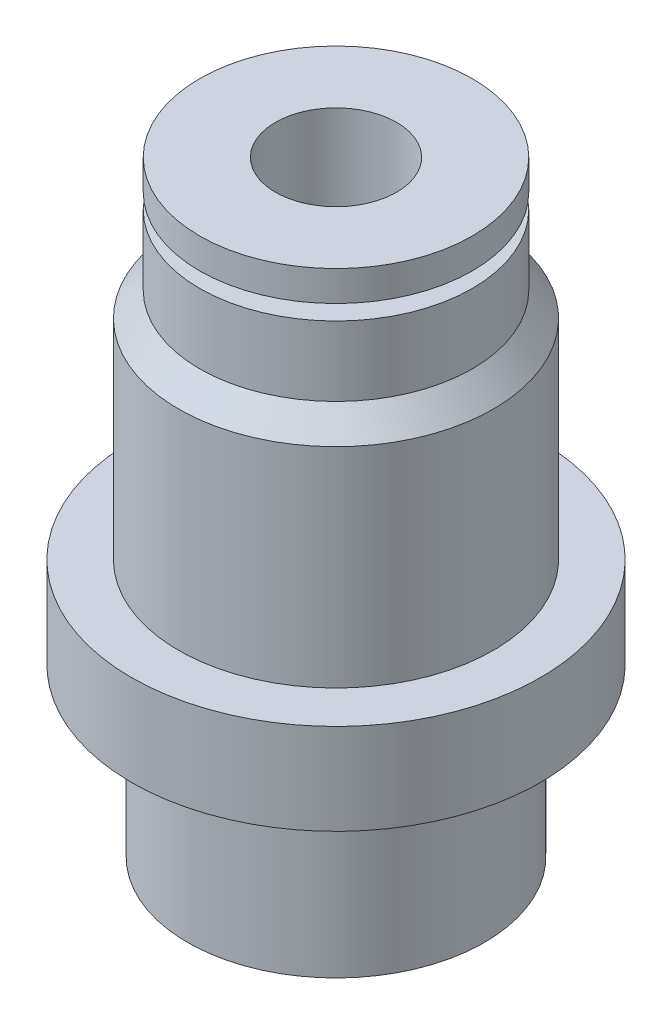
from build123d import *


with BuildPart() as part:
    # Эскиз1 → Повернуть1 (revolve)
    with BuildSketch(Plane.XY, mode=Mode.PRIVATE) as revolve_1_sk:
        Polygon((4.5, 20), (2, 20), (2, 5.5), (2.1, 5.5), (2.1, 0), (4.9, 0), (4.9, 5.5), (6.75, 5.5), (6.75, 8.5), (5.196152423, 8.5), (5.196152423, 15.4), (4.5, 16.2), (4.5, 18.5), (3, 18.5), (3, 19), (4.5, 19), align=None)
    revolve(revolve_1_sk.sketch.rotate(Axis((0, 0, 0), (0, 1, 0)), 90), axis=Axis((0, 0, 0), (0, 1, 0)))


solid = part.part
